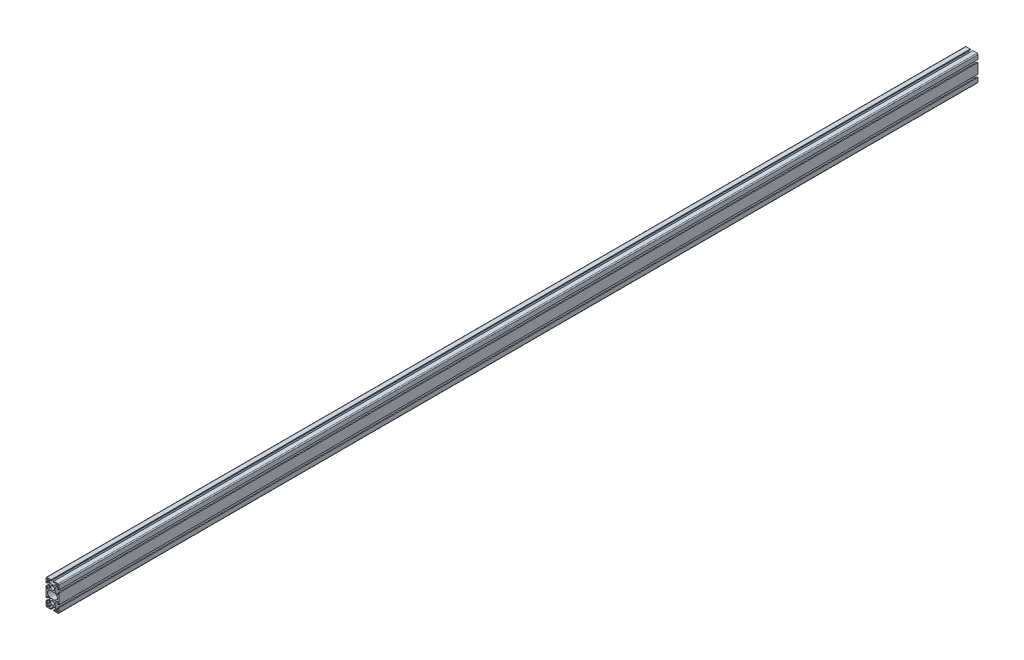
from build123d import *

# Parameters (mm, degrees)
SKETCH1_R           = 2.5
SKETCH1_R_2         = 6
BOSS_EXTRUDE1_DEPTH = 2860


with BuildPart() as part:
    # Sketch1 → Boss-Extrude1 (new body)
    with BuildSketch(Plane.XY):
        with BuildLine():
            Line((-17, -40), (-4.1, -40))
            Line((-4.1, -40), (-4.1, -37))
            Line((-4.1, -37), (-10.5, -37))
            Line((-10.5, -37), (-10.5, -33.6627417))
            ThreePointArc((-10.5, -33.6627417), (-10.378207252, -33.050448208), (-10.03137085, -32.53137085))
            Line((-10.03137085, -32.53137085), (-7.464466094, -29.964466094))
            ThreePointArc((-7.464466094, -29.964466094), (-5.84234935, -28.880602337), (-3.928932188, -28.5))
            Line((-3.928932188, -28.5), (3.928932188, -28.5))
            ThreePointArc((3.928932188, -28.5), (5.84234935, -28.880602337), (7.464466094, -29.964466094))
            Line((7.464466094, -29.964466094), (10.03137085, -32.53137085))
            ThreePointArc((10.03137085, -32.53137085), (10.378207252, -33.050448208), (10.5, -33.6627417))
            Line((10.5, -33.6627417), (10.5, -37))
            Line((10.5, -37), (4.1, -37))
            Line((4.1, -37), (4.1, -40))
            Line((4.1, -40), (17, -40))
            ThreePointArc((17, -40), (19.121320344, -39.121320344), (20, -37))
            Line((20, -37), (20, -24.1))
            Line((20, -24.1), (17, -24.1))
            Line((17, -24.1), (17, -30.5))
            Line((17, -30.5), (13.6627417, -30.5))
            ThreePointArc((13.6627417, -30.5), (13.050448208, -30.378207252), (12.53137085, -30.03137085))
            Line((12.53137085, -30.03137085), (9.964466094, -27.464466094))
            ThreePointArc((9.964466094, -27.464466094), (8.880602337, -25.84234935), (8.5, -23.928932188))
            Line((8.5, -23.928932188), (8.5, -16.071067812))
            ThreePointArc((8.5, -16.071067812), (8.880602337, -14.15765065), (9.964466094, -12.535533906))
            Line((9.964466094, -12.535533906), (12.53137085, -9.96862915))
            ThreePointArc((12.53137085, -9.96862915), (13.050448208, -9.621792748), (13.6627417, -9.5))
            Line((13.6627417, -9.5), (17, -9.5))
            Line((17, -9.5), (17, -15.9))
            Line((17, -15.9), (20, -15.9))
            Line((20, -15.9), (20, 15.9))
            Line((20, 15.9), (17, 15.9))
            Line((17, 15.9), (17, 9.5))
            Line((17, 9.5), (13.6627417, 9.5))
            ThreePointArc((13.6627417, 9.5), (13.050448208, 9.621792748), (12.53137085, 9.96862915))
            Line((12.53137085, 9.96862915), (9.964466094, 12.535533906))
            ThreePointArc((9.964466094, 12.535533906), (8.880602337, 14.15765065), (8.5, 16.071067812))
            Line((8.5, 16.071067812), (8.5, 23.928932188))
            ThreePointArc((8.5, 23.928932188), (8.880602337, 25.84234935), (9.964466094, 27.464466094))
            Line((9.964466094, 27.464466094), (12.53137085, 30.03137085))
            ThreePointArc((12.53137085, 30.03137085), (13.050448208, 30.378207252), (13.6627417, 30.5))
            Line((13.6627417, 30.5), (17, 30.5))
            Line((17, 30.5), (17, 24.1))
            Line((17, 24.1), (20, 24.1))
            Line((20, 24.1), (20, 37))
            ThreePointArc((20, 37), (19.121320344, 39.121320344), (17, 40))
            Line((17, 40), (4.1, 40))
            Line((4.1, 40), (4.1, 37))
            Line((4.1, 37), (10.5, 37))
            Line((10.5, 37), (10.5, 33.6627417))
            ThreePointArc((10.5, 33.6627417), (10.378207252, 33.050448208), (10.03137085, 32.53137085))
            Line((10.03137085, 32.53137085), (7.464466094, 29.964466094))
            ThreePointArc((7.464466094, 29.964466094), (5.84234935, 28.880602337), (3.928932188, 28.5))
            Line((3.928932188, 28.5), (-3.928932188, 28.5))
            ThreePointArc((-3.928932188, 28.5), (-5.84234935, 28.880602337), (-7.464466094, 29.964466094))
            Line((-7.464466094, 29.964466094), (-10.03137085, 32.53137085))
            ThreePointArc((-10.03137085, 32.53137085), (-10.378207252, 33.050448208), (-10.5, 33.6627417))
            Line((-10.5, 33.6627417), (-10.5, 37))
            Line((-10.5, 37), (-4.1, 37))
            Line((-4.1, 37), (-4.1, 40))
            Line((-4.1, 40), (-17, 40))
            ThreePointArc((-17, 40), (-19.121320344, 39.121320344), (-20, 37))
            Line((-20, 37), (-20, 24.1))
            Line((-20, 24.1), (-17, 24.1))
            Line((-17, 24.1), (-17, 30.5))
            Line((-17, 30.5), (-13.6627417, 30.5))
            ThreePointArc((-13.6627417, 30.5), (-13.050448208, 30.378207252), (-12.53137085, 30.03137085))
            Line((-12.53137085, 30.03137085), (-9.964466094, 27.464466094))
            ThreePointArc((-9.964466094, 27.464466094), (-8.880602337, 25.84234935), (-8.5, 23.928932188))
            Line((-8.5, 23.928932188), (-8.5, 16.071067812))
            ThreePointArc((-8.5, 16.071067812), (-8.880602337, 14.15765065), (-9.964466094, 12.535533906))
            Line((-9.964466094, 12.535533906), (-12.53137085, 9.96862915))
            ThreePointArc((-12.53137085, 9.96862915), (-13.050448208, 9.621792748), (-13.6627417, 9.5))
            Line((-13.6627417, 9.5), (-17, 9.5))
            Line((-17, 9.5), (-17, 15.9))
            Line((-17, 15.9), (-20, 15.9))
            Line((-20, 15.9), (-20, -15.9))
            Line((-20, -15.9), (-17, -15.9))
            Line((-17, -15.9), (-17, -9.5))
            Line((-17, -9.5), (-13.6627417, -9.5))
            ThreePointArc((-13.6627417, -9.5), (-13.050448208, -9.621792748), (-12.53137085, -9.96862915))
            Line((-12.53137085, -9.96862915), (-9.964466094, -12.535533906))
            ThreePointArc((-9.964466094, -12.535533906), (-8.880602337, -14.15765065), (-8.5, -16.071067812))
            Line((-8.5, -16.071067812), (-8.5, -23.928932188))
            ThreePointArc((-8.5, -23.928932188), (-8.880602337, -25.84234935), (-9.964466094, -27.464466094))
            Line((-9.964466094, -27.464466094), (-12.53137085, -30.03137085))
            ThreePointArc((-12.53137085, -30.03137085), (-13.050448208, -30.378207252), (-13.6627417, -30.5))
            Line((-13.6627417, -30.5), (-17, -30.5))
            Line((-17, -30.5), (-17, -24.1))
            Line((-17, -24.1), (-20, -24.1))
            Line((-20, -24.1), (-20, -37))
            ThreePointArc((-20, -37), (-19.121320344, -39.121320344), (-17, -40))
        make_face()
        with Locations((15, 35)):
            Circle(SKETCH1_R, mode=Mode.SUBTRACT)
        with Locations((15, -35)):
            Circle(SKETCH1_R, mode=Mode.SUBTRACT)
        with Locations((0, 20)):
            Circle(SKETCH1_R_2, mode=Mode.SUBTRACT)
        with Locations((0, -20)):
            Circle(SKETCH1_R_2, mode=Mode.SUBTRACT)
        with Locations((-15, 35)):
            Circle(SKETCH1_R, mode=Mode.SUBTRACT)
        with Locations((-15, -35)):
            Circle(SKETCH1_R, mode=Mode.SUBTRACT)
        with BuildLine():
            Line((-14.242640687, -4.242640687), (-9.949747468, -8.535533906))
            ThreePointArc((-9.949747468, -8.535533906), (-8.327630724, -9.619397663), (-6.414213562, -10))
            Line((-6.414213562, -10), (6.414213562, -10))
            ThreePointArc((6.414213562, -10), (8.327630724, -9.619397663), (9.949747468, -8.535533906))
            Line((9.949747468, -8.535533906), (14.242640687, -4.242640687))
            ThreePointArc((14.242640687, -4.242640687), (16, 0), (14.242640687, 4.242640687))
            Line((14.242640687, 4.242640687), (9.949747468, 8.535533906))
            ThreePointArc((9.949747468, 8.535533906), (8.327630724, 9.619397663), (6.414213562, 10))
            Line((6.414213562, 10), (-6.414213562, 10))
            ThreePointArc((-6.414213562, 10), (-8.327630724, 9.619397663), (-9.949747468, 8.535533906))
            Line((-9.949747468, 8.535533906), (-14.242640687, 4.242640687))
            ThreePointArc((-14.242640687, 4.242640687), (-16, 0), (-14.242640687, -4.242640687))
        make_face(mode=Mode.SUBTRACT)
    extrude(amount=-BOSS_EXTRUDE1_DEPTH)


solid = part.part
